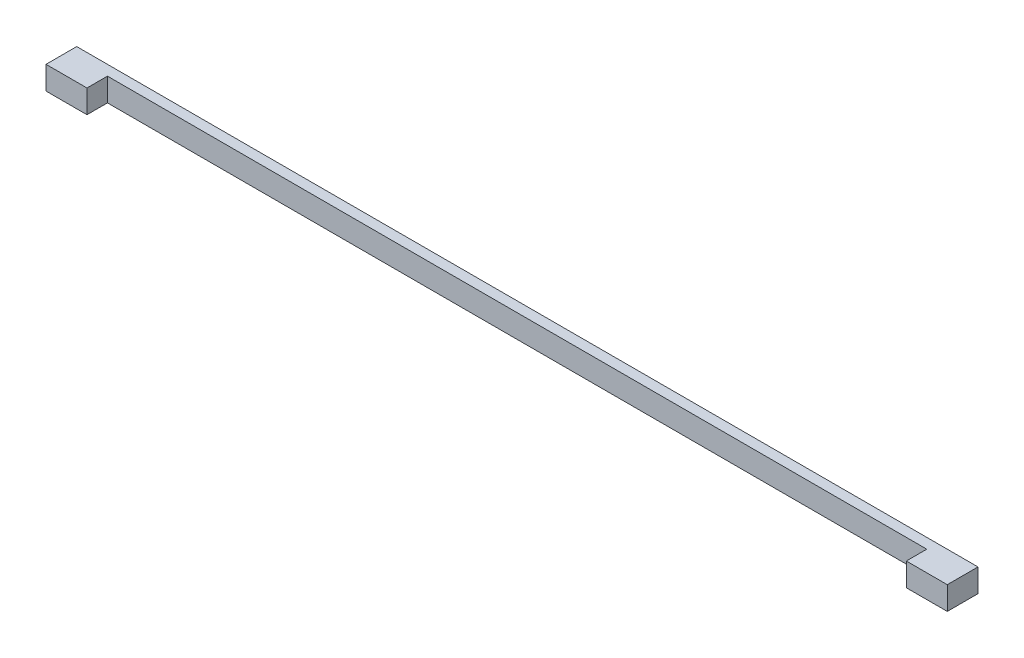
from build123d import *

# Parameters (mm, degrees)
SKETCH_1_W      = 440
SKETCH_1_H      = 11.320223532
EXTRUDE_1_DEPTH = 5
SKETCH_2_W      = 20
SKETCH_2_H      = 11.320223532
EXTRUDE_2_DEPTH = 10


with BuildPart() as part:
    # 스케치1 → 보스-돌출1 (new body)
    with BuildSketch(Plane.XY):
        Rectangle(SKETCH_1_W, SKETCH_1_H)
    extrude(amount=EXTRUDE_1_DEPTH)

    # 스케치2 → 보스-돌출2 (add)
    with BuildSketch(Plane.XY.offset(5)):
        with Locations((-210, 0)):
            Rectangle(SKETCH_2_W, SKETCH_2_H)
        with Locations((210, 0)):
            Rectangle(SKETCH_2_W, SKETCH_2_H)
    extrude(amount=EXTRUDE_2_DEPTH)


solid = part.part
